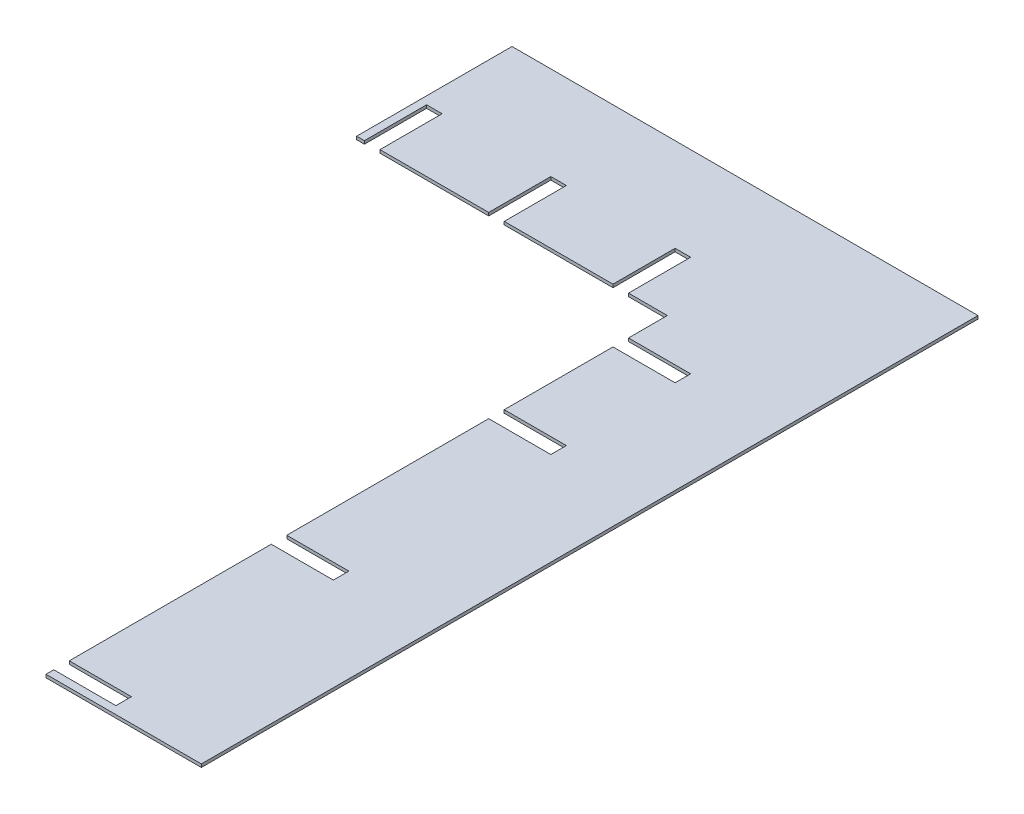
from build123d import *

# Parameters (mm, degrees)
BOSS_EXTRUDE1_DEPTH = 1


with BuildPart() as part:
    # Sketch1 → Boss-Extrude1 (new body)
    with BuildSketch(Plane(origin=(0, 0, 0), x_dir=(1, 0, 0), z_dir=(0, 1, 0))):
        Polygon((0, 0), (2.5, 0), (2.5, 20), (7.5, 20), (7.5, 0), (42.5, 0), (42.5, 20), (47.5, 20), (47.5, 0), (82.5, 0), (82.5, 20), (87.5, 20), (87.5, 0), (100, 0), (100, -12.5), (120, -12.5), (120, -17.5), (100, -17.5), (100, -52.5), (120, -52.5), (120, -57.5), (100, -57.5), (100, -122.5), (120, -122.5), (120, -127.5), (100, -127.5), (100, -192.5), (120, -192.5), (120, -197.5), (100, -197.5), (100, -200), (150, -200), (150, 50), (0, 50), align=None)
    extrude(amount=BOSS_EXTRUDE1_DEPTH)


solid = part.part
